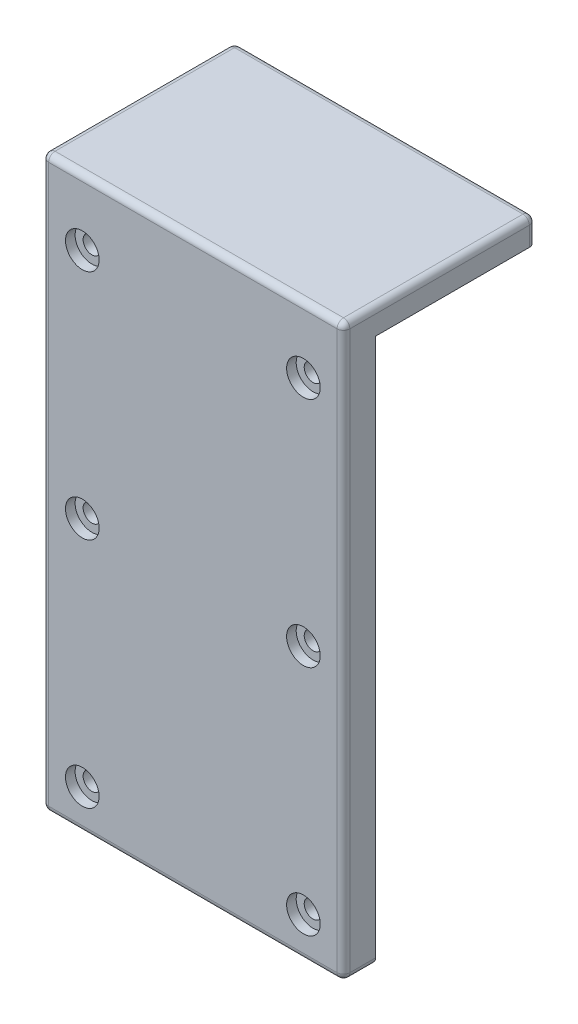
from build123d import *

# Parameters (mm, degrees)
SKETCH1_W                       = 94
SKETCH1_H                       = 170
BOSS_EXTRUDE1_DEPTH             = 10
CBORE_FOR_M5_SBHCS1_D           = 5.5
CBORE_FOR_M5_SBHCS1_CBORE_D     = 10.5
CBORE_FOR_M5_SBHCS1_CBORE_DEPTH = 3
SKETCH4_W                       = 94
SKETCH4_H                       = 60
BOSS_EXTRUDE2_DEPTH             = 8
FILLET1_R                       = 2
M4X0_7_TAPPED_HOLE1_D           = 3.3
M4X0_7_TAPPED_HOLE1_DEPTH       = 8


with BuildPart() as part:
    # Sketch1 → Boss-Extrude1 (new body)
    with BuildSketch(Plane.XY):
        with Locations((47, 85)):
            Rectangle(SKETCH1_W, SKETCH1_H)
    extrude(amount=BOSS_EXTRUDE1_DEPTH)

    # CBORE for M5 SBHCS1 (through all)
    with Locations(Plane.XY.offset(10)):
        with Locations((81.5, 157.5), (12.5, 85), (12.5, 157.5), (81.5, 85), (12.5, 12.5), (81.5, 12.5)):
            CounterBoreHole(CBORE_FOR_M5_SBHCS1_D / 2, CBORE_FOR_M5_SBHCS1_CBORE_D / 2, CBORE_FOR_M5_SBHCS1_CBORE_DEPTH)

    # Sketch4 → Boss-Extrude2 (add)
    with BuildSketch(Plane(origin=(0, 170, 0), x_dir=(1, 0, 0), z_dir=(0, 1, 0))):
        with Locations((47, 20)):
            Rectangle(SKETCH4_W, SKETCH4_H)
    extrude(amount=BOSS_EXTRUDE2_DEPTH)

    # Fillet1
    fillet1_edges = [part.edges().sort_by_distance(p)[0] for p in [
        (94, 89, 10),
        (0, 89, 10),
        (0, 174, -50),
        (94, 174, -50),
        (0, 178, -20),
        (47, 178, 10),
        (94, 178, -20),
        (47, 178, -50),
        (94, 0, 5),
        (0, 0, 5),
        (47, 0, 10),
    ]]
    fillet(fillet1_edges, radius=FILLET1_R)

    # M4x0.7 Tapped Hole1
    with Locations(Plane(origin=(0, 0, 0), x_dir=(-1, 0, 0), z_dir=(0, 0, -1))):
        with Locations((-47, 140), (-47, 49)):
            Hole(M4X0_7_TAPPED_HOLE1_D / 2, depth=M4X0_7_TAPPED_HOLE1_DEPTH)


solid = part.part
